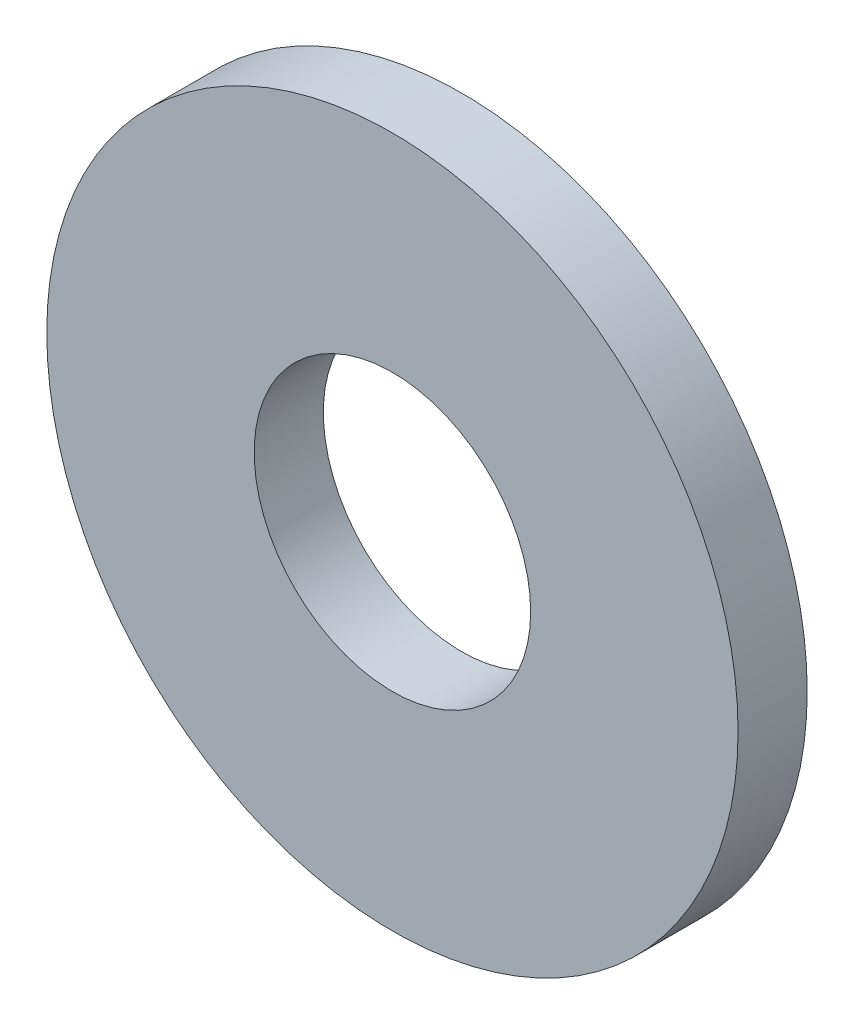
from build123d import *

# Parameters (mm, degrees)
ESQUISSE1_R        = 5
ESQUISSE1_R_2      = 2
BOSS_EXTRU_1_DEPTH = 1


with BuildPart() as part:
    # Esquisse1 → Boss.-Extru.1 (new body)
    with BuildSketch(Plane.XY):
        Circle(ESQUISSE1_R)
        Circle(ESQUISSE1_R_2, mode=Mode.SUBTRACT)
    extrude(amount=BOSS_EXTRU_1_DEPTH)


solid = part.part
